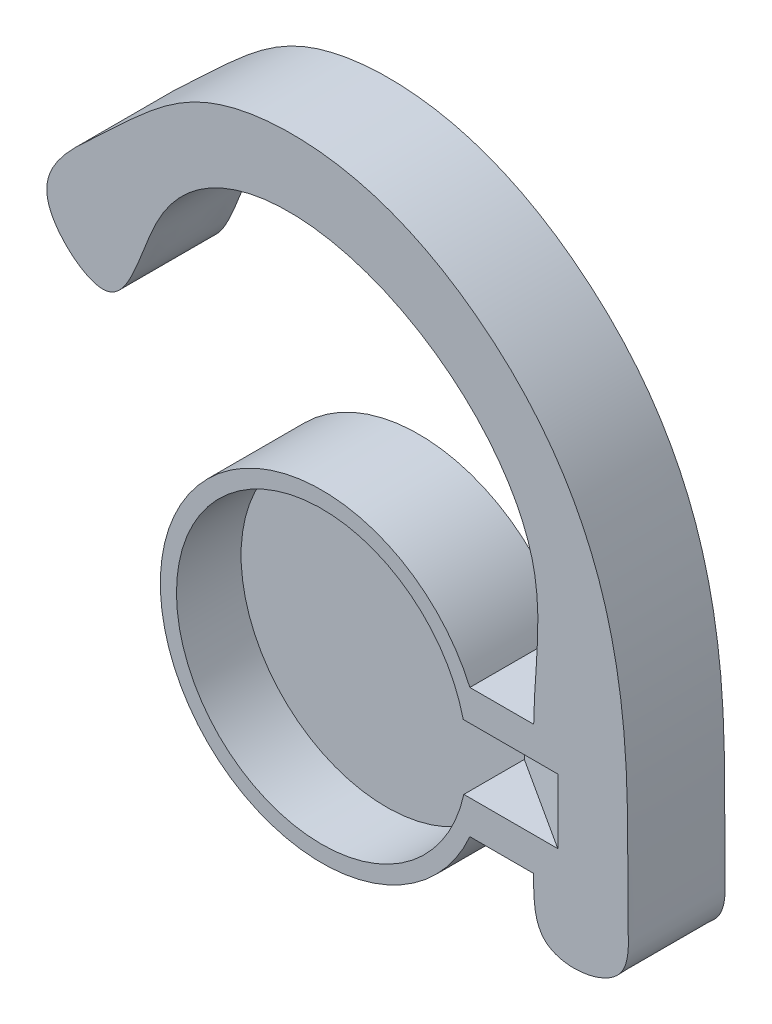
from build123d import *

# Parameters (mm, degrees)
BOSS_EXTRUDE1_DEPTH = 9.525
SKETCH3_R           = 14.2875
CUT_EXTRUDE1_DEPTH  = 6.35
CUT_EXTRUDE3_START  = -3.302
CUT_EXTRUDE3_DEPTH  = 6.35


with BuildPart() as part:
    # Sketch2 → Boss-Extrude1 (new body)
    with BuildSketch(Plane.XY):
        with BuildLine():
            Line((14.549677797, 6.350000078), (20.825267235, 6.349999885))
            add(Edge.make_bspline(
                [(20.825267235, 6.349999885), (20.849363884, 10.801122689), (23.737223662, 25.64509364), (2.091673977, 41.958101218), (-16.778058511, 34.748849125), (-19.351650649, 18.64242388), (-29.994485957, 27.919534034), (-20.432962728, 36.245863255), (-12.344440577, 44.68692946), (2.991836153, 45.361211918), (14.43097862, 39.596029181), (22.511864048, 31.713244276), (27.807947907, 22.064119885), (30.354809929, 8.821158137), (29.978766585, -1.843521852), (30.282095771, -12.169592536), (20.657114955, -13.541646534), (20.82180965, -8.150015026), (20.82526726, -6.350000115)],
                knots=[0.002766334, 0.002766334, 0.002766334, 0.002766334, 0.067803658, 0.213761885, 0.286376821, 0.336462758, 0.371584811, 0.416644442, 0.481575794, 0.551682992, 0.618604227, 0.66565065, 0.714590453, 0.777516086, 0.8578608, 0.878753047, 0.915074115, 0.940871873, 0.940871873, 0.940871873, 0.940871873], degree=3))
            Line((20.82526726, -6.350000115), (14.549677831, -6.35))
            ThreePointArc((14.549677831, -6.35), (-15.875, -4.3e-08), (14.549677797, 6.350000078))
        make_face()
    extrude(amount=BOSS_EXTRUDE1_DEPTH)

    # Sketch3 → Cut-Extrude1 (cut)
    with BuildSketch(Plane.XY.offset(9.525)):
        Circle(SKETCH3_R)
    extrude(amount=-CUT_EXTRUDE1_DEPTH, mode=Mode.SUBTRACT)

    # Sketch5 → Cut-Extrude3 (cut)
    with BuildSketch(Plane(origin=(-1.16e-07, -6.349999734, 0), x_dir=(0.9999999999999999, -1.8265120306968774e-08, 0), z_dir=(-1.8265120306968774e-08, -0.9999999999999999, 0)).offset(CUT_EXTRUDE3_START)):
        Polygon((13.339282168, 3.175), (25.951320602, 11.302244395), (13.339282168, 11.302244395), align=None)
    extrude(amount=-CUT_EXTRUDE3_DEPTH, mode=Mode.SUBTRACT)


solid = part.part
